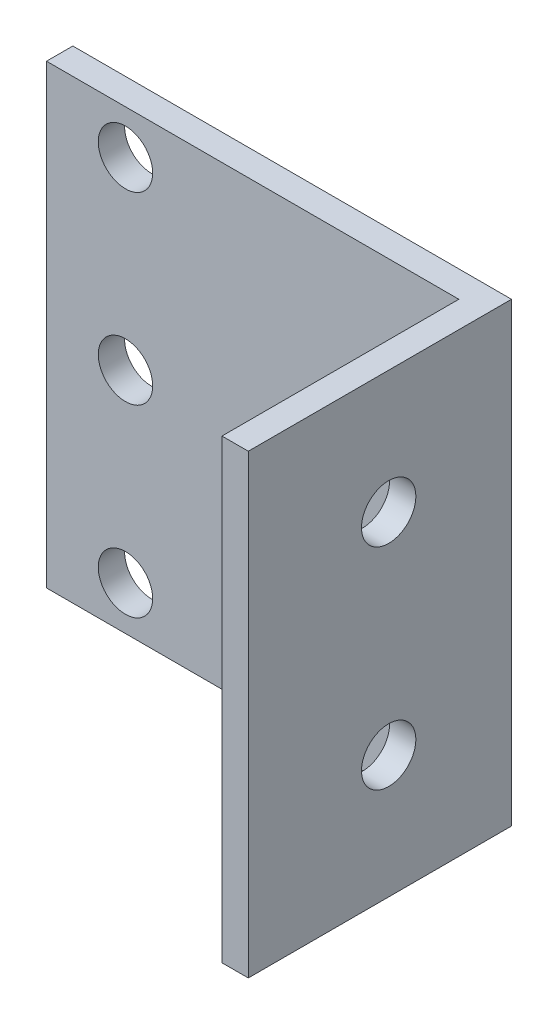
from build123d import *

# Parameters (mm, degrees)
SKETCH1_W           = 25
SKETCH1_H           = 26
SKETCH1_R           = 1.55
BOSS_EXTRUDE1_DEPTH = 1.5
SKETCH2_W           = 1.5
SKETCH2_H           = 26
BOSS_EXTRUDE2_DEPTH = 13.5
SKETCH3_R           = 1.55
CUT_EXTRUDE1_DEPTH  = 13


with BuildPart() as part:
    # Sketch1 → Boss-Extrude1 (new body)
    with BuildSketch(Plane.XY):
        with Locations((8, 0)):
            Rectangle(SKETCH1_W, SKETCH1_H)
        with Locations((0, 10.5)):
            Circle(SKETCH1_R, mode=Mode.SUBTRACT)
        Circle(SKETCH1_R, mode=Mode.SUBTRACT)
        with Locations((0, -10.5)):
            Circle(SKETCH1_R, mode=Mode.SUBTRACT)
    extrude(amount=BOSS_EXTRUDE1_DEPTH)

    # Sketch2 → Boss-Extrude2 (add)
    with BuildSketch(Plane.XY.offset(1.5)):
        with Locations((19.75, 0)):
            Rectangle(SKETCH2_W, SKETCH2_H)
    extrude(amount=BOSS_EXTRUDE2_DEPTH)

    # Sketch3 → Cut-Extrude1 (cut)
    with BuildSketch(Plane(origin=(20.5, 0, 0), x_dir=(0, 0, -1), z_dir=(1, 0, 0))):
        with Locations((-7, 6)):
            Circle(SKETCH3_R)
        with Locations((-7, -6)):
            Circle(SKETCH3_R)
    extrude(amount=-CUT_EXTRUDE1_DEPTH, mode=Mode.SUBTRACT)


solid = part.part
